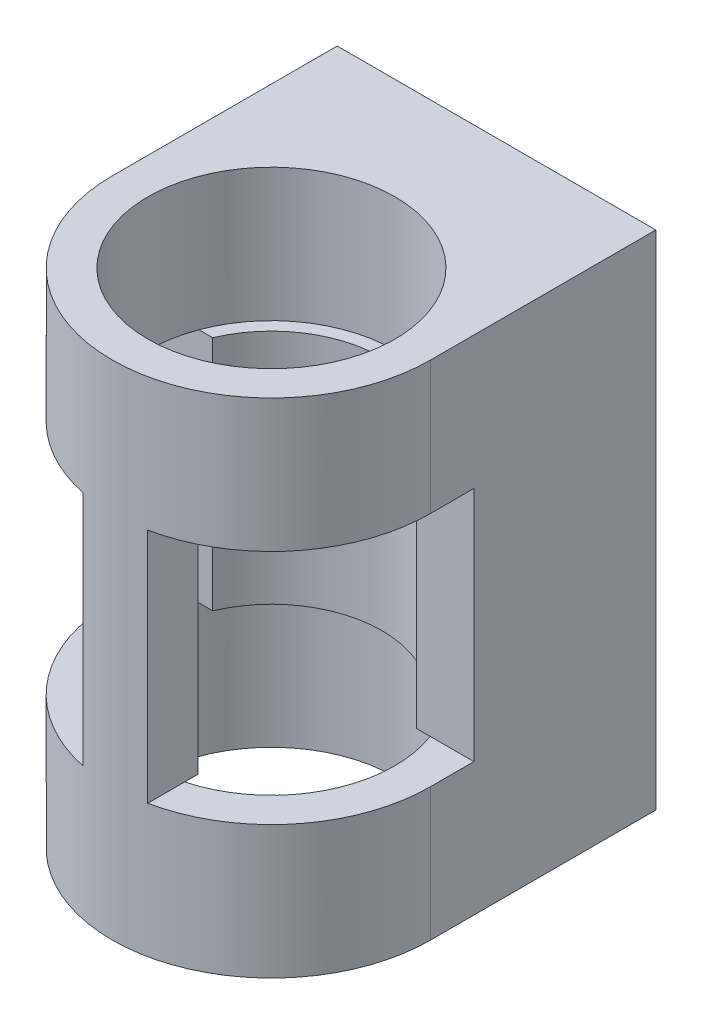
from build123d import *

# Parameters (mm, degrees)
SKETCH1_R           = 9.25
BOSS_EXTRUDE1_DEPTH = 42
SKETCH2_R           = 10.31875
CUT_EXTRUDE1_DEPTH  = 11.1125
SKETCH3_R           = 10.3175
CUT_EXTRUDE2_DEPTH  = 11.1125
CUT_EXTRUDE3_DEPTH  = 19.775
SKETCH5_R           = 3
CUT_EXTRUDE4_DEPTH  = 8
SKETCH6_W           = 19
SKETCH6_H           = 20
CUT_EXTRUDE5_DEPTH  = 6
FILLET1_R           = 2.38


with BuildPart() as part:
    # Sketch1 → Boss-Extrude1 (new body)
    with BuildSketch(Plane(origin=(0, 0, 0), x_dir=(1, 0, 0), z_dir=(0, 1, 0))):
        with BuildLine():
            Line((-13.31875, 0), (-13.31875, 13.31875))
            Line((-13.31875, 13.31875), (-13.31875, 17.81875))
            Line((-13.31875, 17.81875), (-13.31875, 18.81875))
            Line((-13.31875, 18.81875), (13.31875, 18.81875))
            Line((13.31875, 18.81875), (13.31875, 17.81875))
            Line((13.31875, 17.81875), (13.31875, 13.31875))
            Line((13.31875, 13.31875), (13.31875, 0))
            ThreePointArc((13.31875, 0), (0, -13.31875), (-13.31875, 0))
        make_face()
        with Locations(Location((0, 0, 0), (0, 0, 90))):
            Circle(SKETCH1_R, mode=Mode.SUBTRACT)
    extrude(amount=BOSS_EXTRUDE1_DEPTH)

    # Sketch2 → Cut-Extrude1 (cut)
    with BuildSketch(Plane(origin=(0, 42, 0), x_dir=(1, 0, 0), z_dir=(0, 1, 0))):
        with Locations(Location((0, 0, 0), (0, 0, 270))):
            Circle(SKETCH2_R)
    extrude(amount=-CUT_EXTRUDE1_DEPTH, mode=Mode.SUBTRACT)

    # Sketch3 → Cut-Extrude2 (cut)
    with BuildSketch(Plane.XZ):
        with Locations(Location((0, 0, 0), (0, 0, 270))):
            Circle(SKETCH3_R)
    extrude(amount=-CUT_EXTRUDE2_DEPTH, mode=Mode.SUBTRACT)

    # Sketch4 → Cut-Extrude3 (cut)
    with BuildSketch(Plane(origin=(0, 30.8875, 0), x_dir=(1, 0, 0), z_dir=(0, 1, 0))):
        Polygon((2.702073717, -6.203740676), (-2.702073717, -6.203740676), (-2.702073717, -16.08189807), (-18.957765954, -16.08189807), (-18.957765954, 3.606897718), (22.504521647, 3.606897718), (22.504521647, -16.08189807), (2.702073717, -16.08189807), align=None)
    extrude(amount=-CUT_EXTRUDE3_DEPTH, mode=Mode.SUBTRACT)

    # Sketch5 → Cut-Extrude4 (cut)
    with BuildSketch(Plane(origin=(0, 0, -18.81875), x_dir=(-1, 0, 0), z_dir=(0, 0, -1))):
        with Locations((-7.81875, 5.5)):
            Circle(SKETCH5_R)
        with Locations((7.81875, 5.5)):
            Circle(SKETCH5_R)
        with Locations((7.81875, 36.5)):
            Circle(SKETCH5_R)
        with Locations((-7.81875, 36.5)):
            Circle(SKETCH5_R)
    extrude(amount=-CUT_EXTRUDE4_DEPTH, mode=Mode.SUBTRACT)

    # Sketch6 → Cut-Extrude5 (cut)
    with BuildSketch(Plane(origin=(0, 0, -18.81875), x_dir=(-1, 0, 0), z_dir=(0, 0, -1))):
        with Locations((0, 21)):
            Rectangle(SKETCH6_W, SKETCH6_H)
    extrude(amount=-CUT_EXTRUDE5_DEPTH, mode=Mode.SUBTRACT)

    # Fillet1
    fillet1_edges = [part.edges().sort_by_distance(p)[0] for p in [
        (-9.5, 31, -15.81875),
        (-9.5, 11, -15.81875),
        (9.5, 11, -15.81875),
        (9.5, 31, -15.81875),
    ]]
    fillet(fillet1_edges, radius=FILLET1_R)


solid = part.part
